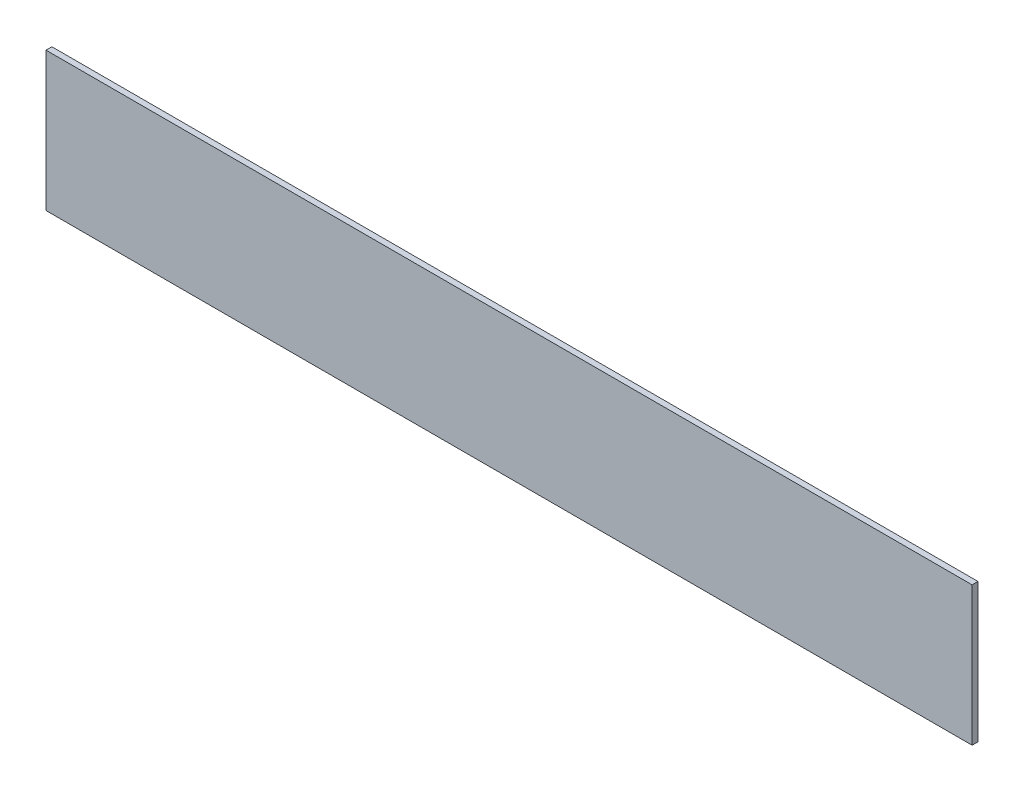
from build123d import *

# Parameters (mm, degrees)
CROQUIS1_W              = 500
CROQUIS1_H              = 75
SALIENTE_EXTRUIR1_DEPTH = 1.5875


with BuildPart() as part:
    # Croquis1 → Saliente-Extruir1 (new, symmetric)
    with BuildSketch(Plane.XY):
        Rectangle(CROQUIS1_W, CROQUIS1_H)
    extrude(amount=SALIENTE_EXTRUIR1_DEPTH, both=True)


solid = part.part
